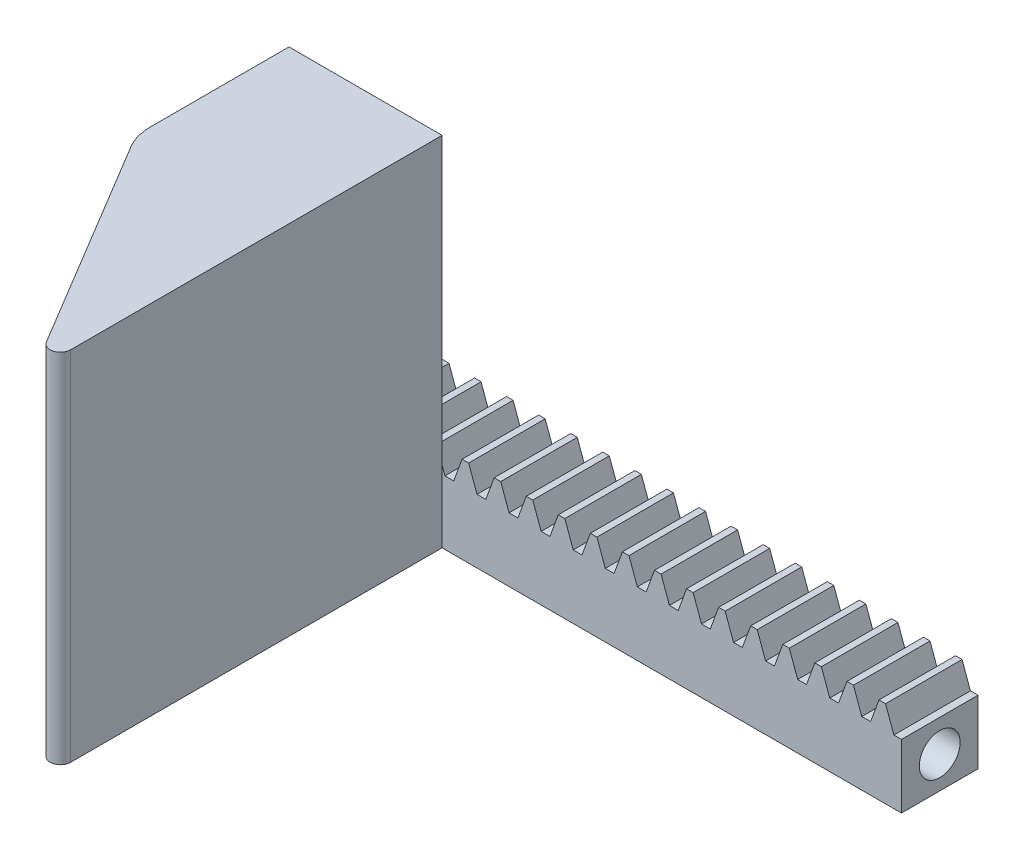
from build123d import *

# Parameters (mm, degrees)
BLANKSKE_W               = 120
BLANKSKE_H               = 17
BLANK_DEPTH              = 15
TOOTHCUTSIM_DEPTH        = 123.122888928
TEETHCUTS_COUNT          = 20
TEETHCUTS_PITCH          = 6.2831853
RESSALTO_EXTRUS_O2_DEPTH = 70
ESBO_O8_R                = 4
CORTE_EXTRUS_O2_DEPTH    = 120


with BuildPart() as part:
    # BlankSke → Blank (new body)
    with BuildSketch(Plane.XY):
        with Locations((60, 8.5)):
            Rectangle(BLANKSKE_W, BLANKSKE_H)
    extrude(amount=-BLANK_DEPTH)

    # TooCutSkeSim → ToothCutSim (cut, through all)
    with BuildSketch(Plane.XY):
        Polygon((0.861870739, 12.5), (-0.861870739, 12.5), (-2.508981637, 17.0254), (2.508981637, 17.0254), align=None)
    toothcutsim = extrude(amount=-TOOTHCUTSIM_DEPTH, mode=Mode.SUBTRACT)

    # TeethCuts: ToothCutSim ×20
    with Locations(*[(i * TEETHCUTS_PITCH, 0, 0) for i in range(1, TEETHCUTS_COUNT)]):
        add(toothcutsim, mode=Mode.SUBTRACT)

    # Esboço8 → Corte-extrusão2 (cut)
    with BuildSketch(Plane.ZY):
        with Locations((-7.5, 6.25)):
            Circle(ESBO_O8_R)
    extrude(amount=-CORTE_EXTRUS_O2_DEPTH, mode=Mode.SUBTRACT)


with BuildPart() as body_2:
    # Esboço5 → Ressalto-extrusão2 (new body)
    with BuildSketch(Plane.XZ):
        with BuildLine():
            Line((0, 0), (30, 0))
            Line((30, 0), (30, 72.779365403))
            ThreePointArc((30, 72.779365403), (28.533867164, 74.70679526), (26.285014149, 73.808356914))
            Line((26.285014149, 73.808356914), (1.425070743, 32.375117905))
            ThreePointArc((1.425070743, 32.375117905), (0.362850718, 29.899496169), (0, 27.230160351))
            Line((0, 27.230160351), (0, 0))
        make_face()
    extrude(amount=-RESSALTO_EXTRUS_O2_DEPTH)


solid = Compound([part.part, body_2.part])
